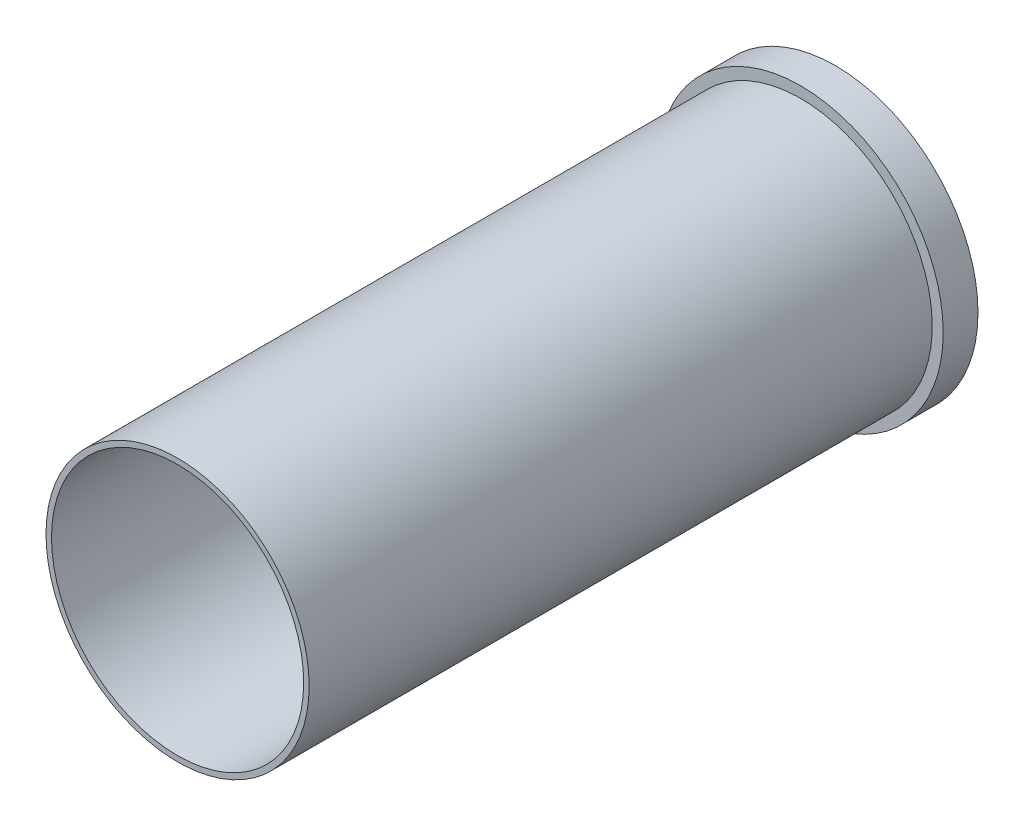
from build123d import *

# Parameters (mm, degrees)
SKETCH1_R           = 24
SKETCH1_R_2         = 23
BOSS_EXTRUDE1_DEPTH = 60
BOSS_EXTRUDE2_START = -6.35
SKETCH2_R           = 26
SKETCH2_R_2         = 24
BOSS_EXTRUDE2_DEPTH = 6.35


with BuildPart() as part:
    # Sketch1 → Boss-Extrude1 (new, symmetric)
    with BuildSketch(Plane.XY):
        Circle(SKETCH1_R)
        Circle(SKETCH1_R_2, mode=Mode.SUBTRACT)
    extrude(amount=BOSS_EXTRUDE1_DEPTH, both=True)

    # Sketch2 → Boss-Extrude2 (add)
    with BuildSketch(Plane(origin=(0, 0, -60), x_dir=(-1, 0, 0), z_dir=(0, 0, -1)).offset(BOSS_EXTRUDE2_START)):
        Circle(SKETCH2_R)
        Circle(SKETCH2_R_2, mode=Mode.SUBTRACT)
    extrude(amount=BOSS_EXTRUDE2_DEPTH)


solid = part.part
